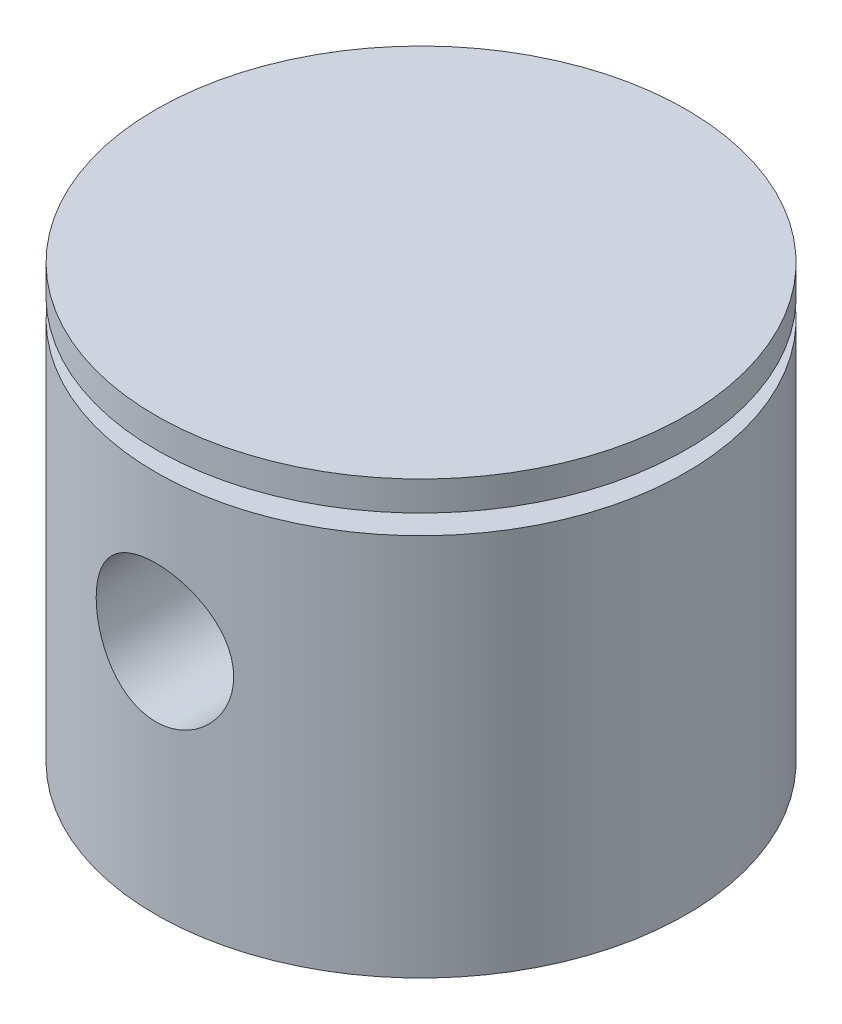
from build123d import *

# Parameters (mm, degrees)
ENL_V_MAT_EXTRU_3_DEPTH      = 30.129023327
ENL_V_MAT_EXTRU_3_DEPTH_BACK = 30.129023327
ESQUISSE12_R                 = 3.5


with BuildPart() as part:
    # Esquisse11 → Révolution5 (revolve)
    with BuildSketch(Plane.XY):
        Polygon((0, 0), (-13.5, 0), (-13.5, -1.5), (-11.5, -1.5), (-11.5, -2.5), (-13.5, -2.5), (-13.5, -22), (-12, -22), (-12, -16), (-7, -16), (-7, -3), (0, -3), align=None)
    revolve(axis=Axis((0, 0, 0), (0, -1, 0)))

    # Esquisse12 → Enlèv. mat.-Extru.3 (cut, two sides: drawn at the far end of the back side and taken through both)
    with BuildSketch(Plane.XY.offset(-ENL_V_MAT_EXTRU_3_DEPTH_BACK)):
        with Locations((0, -10)):
            Circle(ESQUISSE12_R)
    extrude(amount=ENL_V_MAT_EXTRU_3_DEPTH + ENL_V_MAT_EXTRU_3_DEPTH_BACK, mode=Mode.SUBTRACT)


solid = part.part
